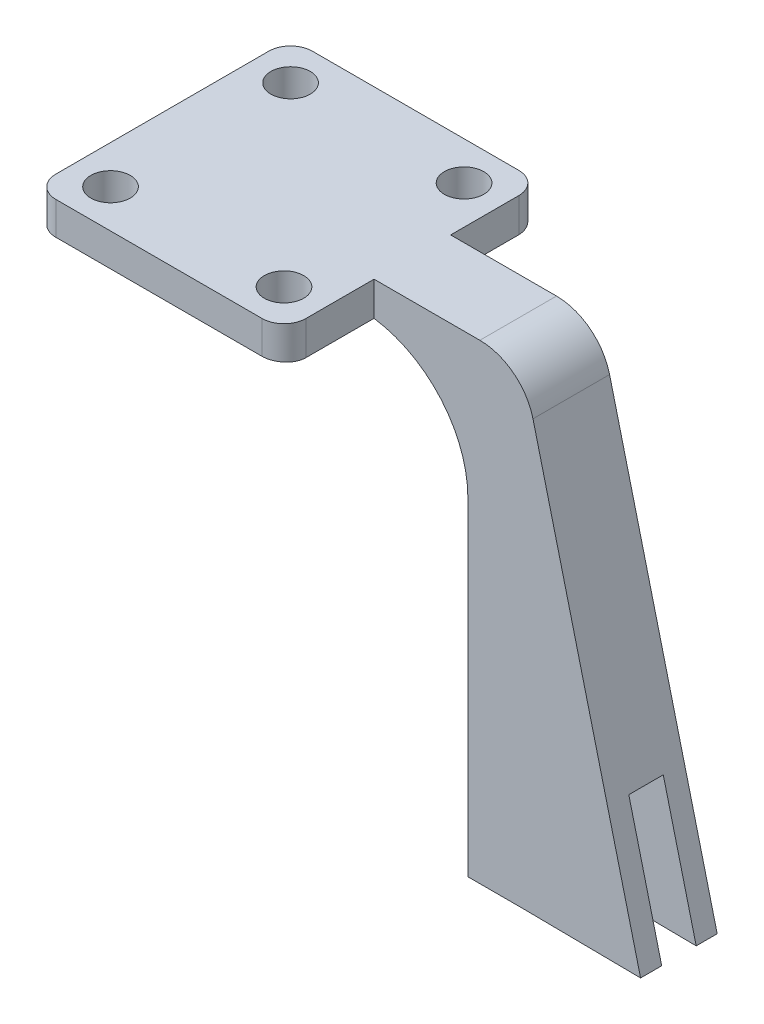
from build123d import *

# Parameters (mm, degrees)
SKETCH1_R           = 1.8
BOSS_EXTRUDE1_DEPTH = 3
SKETCH2_R           = 1.8
CUT_EXTRUDE1_DEPTH  = 17.643504739
SKETCH3_W           = 25
SKETCH3_H           = 7
BOSS_EXTRUDE2_DEPTH = 3
SKETCH4_W           = 5
SKETCH4_H           = 7
BOSS_EXTRUDE3_DEPTH = 40
BOSS_EXTRUDE4_DEPTH = 7
SKETCH12_W          = 5
SKETCH12_H          = 7
BOSS_EXTRUDE5_DEPTH = 2
FILLET1_R           = 10
FILLET2_R           = 5
SKETCH13_W          = 18.381081226
SKETCH13_H          = 3.15
CUT_EXTRUDE2_DEPTH  = 12
SKETCH14_W          = 6.085668667
SKETCH14_H          = 3.15
CUT_EXTRUDE3_DEPTH  = 11


with BuildPart() as part:
    # Sketch1 → Boss-Extrude1 (new body)
    with BuildSketch(Plane(origin=(0, 0, 0), x_dir=(1, 0, 0), z_dir=(0, 1, 0))):
        with BuildLine():
            Line((-9.425, -11.725), (9.425, -11.725))
            ThreePointArc((9.425, -11.725), (10.839213562, -11.139213562), (11.425, -9.725))
            Line((11.425, -9.725), (11.425, 9.725))
            ThreePointArc((11.425, 9.725), (10.839213562, 11.139213562), (9.425, 11.725))
            Line((9.425, 11.725), (-9.425, 11.725))
            ThreePointArc((-9.425, 11.725), (-10.839213562, 11.139213562), (-11.425, 9.725))
            Line((-11.425, 9.725), (-11.425, -9.725))
            ThreePointArc((-11.425, -9.725), (-10.839213562, -11.139213562), (-9.425, -11.725))
        make_face()
        with Locations(Location((-7.925, 8.225, 0), (0, 0, 270))):
            Circle(SKETCH1_R, mode=Mode.SUBTRACT)
    extrude(amount=BOSS_EXTRUDE1_DEPTH)

    # Sketch2 → Cut-Extrude1 (cut, through all)
    with BuildSketch(Plane(origin=(0, 3, 0), x_dir=(1, 0, 0), z_dir=(0, 1, 0))):
        with Locations(Location((7.925, 8.225, 0), (0, 0, 270))):
            Circle(SKETCH2_R)
        with Locations(Location((-7.925, -8.225, 0), (0, 0, 270))):
            Circle(SKETCH2_R)
        with Locations(Location((7.925, -8.225, 0), (0, 0, 270))):
            Circle(SKETCH2_R)
    extrude(amount=-CUT_EXTRUDE1_DEPTH, mode=Mode.SUBTRACT)

    # Sketch3 → Boss-Extrude2 (add)
    with BuildSketch(Plane(origin=(0, 3, 0), x_dir=(1, 0, 0), z_dir=(0, 1, 0))):
        with Locations((12.5, 0)):
            Rectangle(SKETCH3_W, SKETCH3_H)
    extrude(amount=-BOSS_EXTRUDE2_DEPTH)

    # Sketch4 → Boss-Extrude3 (add)
    with BuildSketch(Plane.XZ):
        with Locations((22.5, 0)):
            Rectangle(SKETCH4_W, SKETCH4_H)
    extrude(amount=BOSS_EXTRUDE3_DEPTH)

    # Sketch7 → Boss-Extrude4 (add)
    with BuildSketch(Plane.XY.offset(3.5)):
        Polygon((25, 3), (35.779116369, -40.119915044), (25, -40), align=None)
    extrude(amount=-BOSS_EXTRUDE4_DEPTH)

    # Sketch12 → Boss-Extrude5 (add)
    with BuildSketch(Plane(origin=(0, 0, 0), x_dir=(1, 0, 0), z_dir=(0, 1, 0))):
        with Locations((22.5, 0)):
            Rectangle(SKETCH12_W, SKETCH12_H)
    extrude(amount=BOSS_EXTRUDE5_DEPTH)

    # Fillet1
    fillet1_edges = [part.edges().sort_by_distance(p)[0] for p in [
        (20, 0, 0),
    ]]
    fillet(fillet1_edges, radius=FILLET1_R)

    # Fillet2
    fillet2_edges = [part.edges().sort_by_distance(p)[0] for p in [
        (25, 3, 0),
    ]]
    fillet(fillet2_edges, radius=FILLET2_R)

    # Sketch13 → Cut-Extrude2 (cut)
    with BuildSketch(Plane(origin=(-0.441841569, -39.71696571, 0), x_dir=(-0.9999381256405767, 0.011124068069294642, 0), z_dir=(-0.011124068069294644, -0.9999381256405768, 0))):
        with Locations((-28.924615029, 0.005980727)):
            Rectangle(SKETCH13_W, SKETCH13_H)
    extrude(amount=-CUT_EXTRUDE2_DEPTH, mode=Mode.SUBTRACT)

    # Sketch14 → Cut-Extrude3 (cut)
    with BuildSketch(Plane.XZ.offset(40)):
        with Locations((22.485556971, 0)):
            Rectangle(SKETCH14_W, SKETCH14_H)
    extrude(amount=-CUT_EXTRUDE3_DEPTH, mode=Mode.SUBTRACT)


solid = part.part
